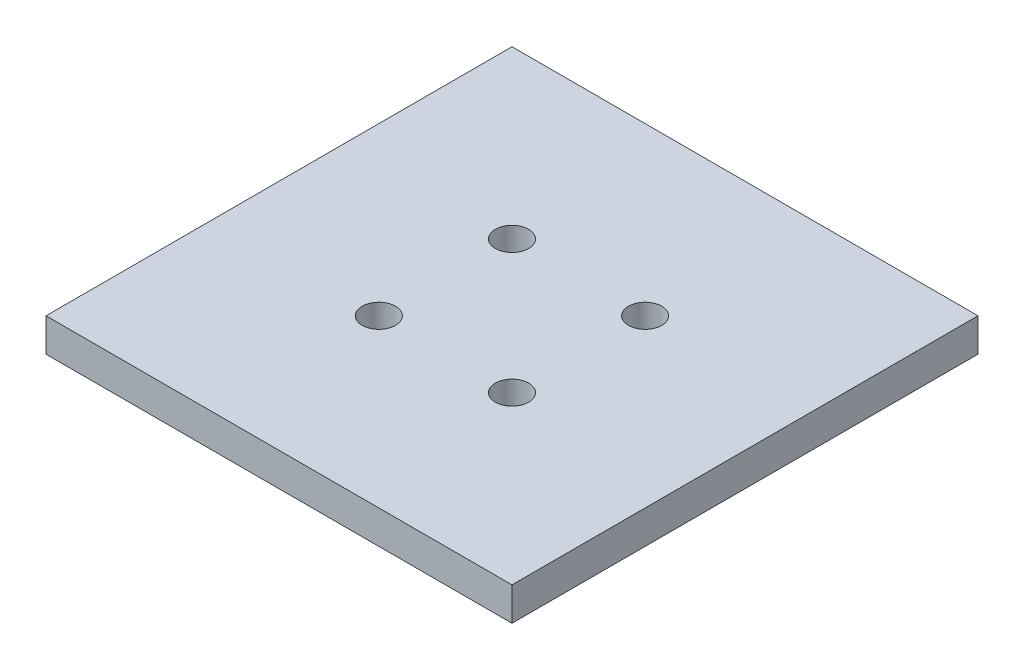
from build123d import *

# Parameters (mm, degrees)
SKETCH1_W           = 88.9
SKETCH1_H           = 88.9
SKETCH1_R           = 3.175
BOSS_EXTRUDE1_DEPTH = 6.35


with BuildPart() as part:
    # Sketch1 → Boss-Extrude1 (new body)
    with BuildSketch(Plane(origin=(0, 0, 0), x_dir=(1, 0, 0), z_dir=(0, 1, 0))):
        Rectangle(SKETCH1_W, SKETCH1_H)
        with Locations(Location((12.7, 12.7, 0), (0, 0, 270))):
            Circle(SKETCH1_R, mode=Mode.SUBTRACT)
        with Locations(Location((12.7, -12.7, 0), (0, 0, 270))):
            Circle(SKETCH1_R, mode=Mode.SUBTRACT)
        with Locations(Location((-12.7, -12.7, 0), (0, 0, 270))):
            Circle(SKETCH1_R, mode=Mode.SUBTRACT)
        with Locations(Location((-12.7, 12.7, 0), (0, 0, 270))):
            Circle(SKETCH1_R, mode=Mode.SUBTRACT)
    extrude(amount=BOSS_EXTRUDE1_DEPTH)


solid = part.part
